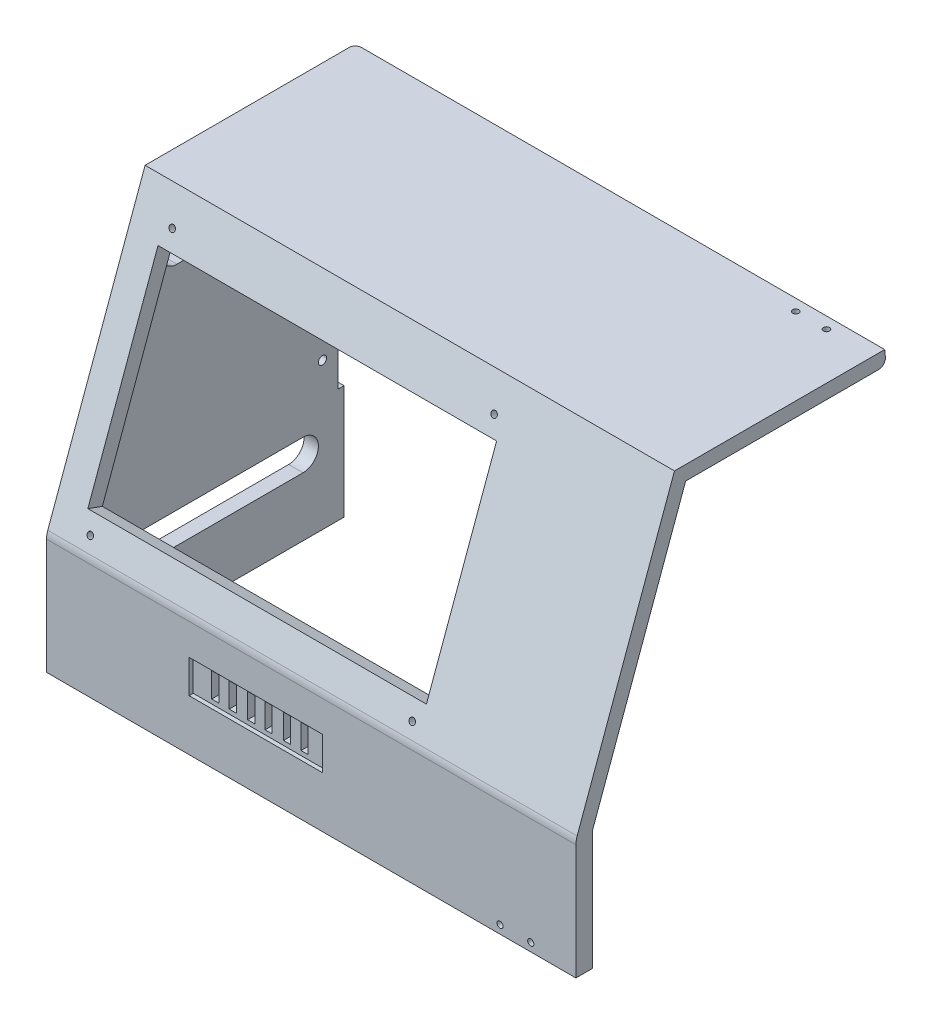
from build123d import *

# Parameters (mm, degrees)
SKETCH1_W                = 170
SKETCH1_H                = 130
BOSS_EXTRUDE1_DEPTH      = 8
SKETCH2_R                = 1.5
SKETCH2_W                = 165
SKETCH2_H                = 100
CUT_EXTRUDE1_DEPTH       = 21
SKETCH3_W                = 170
SKETCH3_H                = 20
BOSS_EXTRUDE2_DEPTH      = 8
SKETCH4_W                = 65
SKETCH4_H                = 16.2
CUT_EXTRUDE2_DEPTH       = 2
SKETCH5_W                = 3.5
SKETCH5_H                = 12
CUT_EXTRUDE3_DEPTH       = 35
SKETCH6_W                = 170
SKETCH6_H                = 150
BOSS_EXTRUDE3_DEPTH      = 8
BOSS_EXTRUDE4_DEPTH      = 138
SKETCH8_W                = 249
SKETCH8_H                = 138
BOSS_EXTRUDE5_DEPTH      = 1
SKETCH9_W                = 72.8
SKETCH9_H                = 73.25
CUT_EXTRUDE4_DEPTH       = 19
BOSS_EXTRUDE6_DEPTH      = 5
SKETCH11_R               = 1.5
CUT_EXTRUDE5_DEPTH       = 56
SKETCH12_R               = 9
SKETCH12_R_2             = 6.5
SKETCH12_R_3             = 1
SKETCH12_R_4             = 2.75
CUT_EXTRUDE6_DEPTH       = 115
SKETCH13_W               = 58.59049163
SKETCH13_H               = 30.075830986
CUT_EXTRUDE7_DEPTH       = 3
FILLET1_R                = 2
SKETCH15_R               = 1.5
CUT_EXTRUDE8_DEPTH       = 10
CUT_EXTRUDE10_DEPTH      = 261
SKETCH19_R               = 1.5
BOSS_EXTRUDE7_DEPTH      = 8
BOSS_EXTRUDE12_START     = -124.5
BOSS_EXTRUDE12_DEPTH     = 249
SKETCH22_R               = 1.5
SKETCH22_W               = 165
SKETCH22_H               = 100
CUT_EXTRUDE11_DEPTH      = 18
FILLET2_R                = 10
SKETCH24_R               = 2
SKETCH24_W               = 3
SKETCH24_H               = 72
CUT_EXTRUDE15_DEPTH      = 42
CUT_EXTRUDE16_DEPTH      = 140
CUT_EXTRUDE16_DEPTH_BACK = 242
SKETCH27_W               = 249
SKETCH27_H               = 105
BOSS_EXTRUDE13_DEPTH     = 7
CUT_EXTRUDE17_DEPTH      = 249
FILLET6_R                = 3
FILLET7_R                = 3
BOSS_EXTRUDE14_DEPTH     = 9
SKETCH30_R               = 1.5
CUT_EXTRUDE18_DEPTH      = 10
SKETCH31_R               = 1.5
CUT_EXTRUDE19_DEPTH      = 49
CUT_EXTRUDE20_DEPTH      = 49


with BuildPart() as part:
    # Sketch1 → Boss-Extrude1 (new body)
    with BuildSketch(Plane.XY):
        with Locations((85, 65)):
            Rectangle(SKETCH1_W, SKETCH1_H)
    extrude(amount=BOSS_EXTRUDE1_DEPTH)

    # Sketch2 → Cut-Extrude1 (cut)
    with BuildSketch(Plane.XY.offset(8)):
        with Locations((6.55, 123.35)):
            Circle(SKETCH2_R)
        with Locations((163.45, 123.35)):
            Circle(SKETCH2_R)
        with Locations((6.55, 6.65)):
            Circle(SKETCH2_R)
        with Locations((163.45, 6.65)):
            Circle(SKETCH2_R)
        with Locations((85, 65)):
            Rectangle(SKETCH2_W, SKETCH2_H)
    extrude(amount=-CUT_EXTRUDE1_DEPTH, mode=Mode.SUBTRACT)

    # Sketch3 → Boss-Extrude2 (add)
    with BuildSketch(Plane.XY.offset(8)):
        with Locations((85, -10)):
            Rectangle(SKETCH3_W, SKETCH3_H)
    extrude(amount=-BOSS_EXTRUDE2_DEPTH)

    # Sketch4 → Cut-Extrude2 (cut)
    with BuildSketch(Plane.XY.offset(8)):
        with Locations((85, -10)):
            Rectangle(SKETCH4_W, SKETCH4_H)
    extrude(amount=-CUT_EXTRUDE2_DEPTH, mode=Mode.SUBTRACT)

    # Sketch5 → Cut-Extrude3 (cut)
    with BuildSketch(Plane.XY.offset(6)):
        with Locations((63.25, -10)):
            Rectangle(SKETCH5_W, SKETCH5_H)
        with Locations((71.75, -10)):
            Rectangle(SKETCH5_W, SKETCH5_H)
        with Locations((80.75, -10)):
            Rectangle(SKETCH5_W, SKETCH5_H)
        with Locations((89.25, -10)):
            Rectangle(SKETCH5_W, SKETCH5_H)
        with Locations((98.25, -10)):
            Rectangle(SKETCH5_W, SKETCH5_H)
        with Locations((106.75, -10)):
            Rectangle(SKETCH5_W, SKETCH5_H)
    extrude(amount=-CUT_EXTRUDE3_DEPTH, mode=Mode.SUBTRACT)

    # Sketch6 → Boss-Extrude3 (add)
    with BuildSketch(Plane.XY.offset(8)):
        Polygon((15.504384948, 140), (225, 140), (225, -35), (-10, -35), (-10, 140), align=None)
        with Locations((85, 55)):
            Rectangle(SKETCH6_W, SKETCH6_H, mode=Mode.SUBTRACT)
    extrude(amount=-BOSS_EXTRUDE3_DEPTH)

    # Sketch7 → Boss-Extrude4 (add)
    with BuildSketch(Plane.XY.offset(8)):
        Polygon((-10, 140), (-17, 140), (-17, -42), (232, -42), (232, 140), (225, 140), (225, -35), (-10, -35), align=None)
    extrude(amount=-BOSS_EXTRUDE4_DEPTH)

    # Sketch8 → Boss-Extrude5 (add)
    with BuildSketch(Plane.XZ.offset(42)):
        with Locations((107.5, -61)):
            Rectangle(SKETCH8_W, SKETCH8_H)
    extrude(amount=BOSS_EXTRUDE5_DEPTH)

    # Sketch9 → Cut-Extrude4 (cut)
    with BuildSketch(Plane(origin=(232, 0, 0), x_dir=(0, 0, -1), z_dir=(1, 0, 0))):
        with Locations((75, 35)):
            Rectangle(SKETCH9_W, SKETCH9_H)
    extrude(amount=-CUT_EXTRUDE4_DEPTH, mode=Mode.SUBTRACT)

    # Sketch10 → Boss-Extrude6 (add)
    with BuildSketch(Plane(origin=(232, 0, 0), x_dir=(0, 0, -1), z_dir=(1, 0, 0))):
        Polygon((36, 44), (36, -4), (114, -4), (114, 44), (119, 44), (119, -9), (31, -9), (31, 44), align=None)
    extrude(amount=BOSS_EXTRUDE6_DEPTH)

    # Sketch11 → Cut-Extrude5 (cut)
    with BuildSketch(Plane(origin=(237, 0, 0), x_dir=(0, 0, -1), z_dir=(1, 0, 0))):
        with Locations((33.5, 17.5)):
            Circle(SKETCH11_R)
        with Locations((116.5, 17.5)):
            Circle(SKETCH11_R)
    extrude(amount=-CUT_EXTRUDE5_DEPTH, mode=Mode.SUBTRACT)

    # Sketch12 → Cut-Extrude6 (cut)
    with BuildSketch(Plane(origin=(0, -35, 0), x_dir=(1, 0, 0), z_dir=(0, 1, 0))):
        with Locations(Location((166.25, 32.5, 0), (0, 0, 180))):
            Circle(SKETCH12_R)
        with Locations(Location((166.25, 97.5, 0), (0, 0, 180))):
            Circle(SKETCH12_R_2)
        with Locations(Location((155.75, 97.5, 0), (0, 0, 180))):
            Circle(SKETCH12_R_3)
        with Locations(Location((155.75, 85, 0), (0, 0, 180))):
            Circle(SKETCH12_R_3)
        with Locations(Location((176.75, 85, 0), (0, 0, 180))):
            Circle(SKETCH12_R_3)
        with Locations(Location((176.75, 97.5, 0), (0, 0, 180))):
            Circle(SKETCH12_R_3)
        with Locations(Location((145.25, 97.5, 0), (0, 0, 180))):
            Circle(SKETCH12_R_4)
        with Locations(Location((187.25, 97.5, 0), (0, 0, 180))):
            Circle(SKETCH12_R_4)
    extrude(amount=-CUT_EXTRUDE6_DEPTH, mode=Mode.SUBTRACT)

    # Sketch13 → Cut-Extrude7 (cut)
    with BuildSketch(Plane.XZ.offset(43)):
        with Locations((166.25, -93.48757215)):
            Rectangle(SKETCH13_W, SKETCH13_H)
    extrude(amount=-CUT_EXTRUDE7_DEPTH, mode=Mode.SUBTRACT)

    # Fillet1
    fillet1_edges = [part.edges().sort_by_distance(p)[0] for p in [
        (136.954754185, -40, -93.48757215),
        (166.25, -40, -78.449656657),
        (195.545245815, -40, -93.48757215),
        (166.25, -40, -108.525487643),
    ]]
    fillet(fillet1_edges, radius=FILLET1_R)

    # Sketch15 → Cut-Extrude8 (cut)
    with BuildSketch(Plane(origin=(0, 140, 0), x_dir=(1, 0, 0), z_dir=(0, 1, 0))):
        with Locations(Location((5, -4, 0), (0, 0, 270))):
            Circle(SKETCH15_R)
        with Locations(Location((20, -4, 0), (0, 0, 270))):
            Circle(SKETCH15_R)
        with Locations(Location((217, -4, 0), (0, 0, 90))):
            Circle(SKETCH15_R)
        with Locations(Location((202, -4, 0), (0, 0, 90))):
            Circle(SKETCH15_R)
    extrude(amount=-CUT_EXTRUDE8_DEPTH, mode=Mode.SUBTRACT)

    # Sketch18 → Cut-Extrude10 (cut)
    with BuildSketch(Plane(origin=(232, 0, 0), x_dir=(0, 0, -1), z_dir=(1, 0, 0))):
        Polygon((45.496279283, 140), (-8, 140), (-8, 15), (0, 15), align=None)
    extrude(amount=-CUT_EXTRUDE10_DEPTH, mode=Mode.SUBTRACT)

    # Sketch19 → Boss-Extrude7 (add)
    with BuildSketch(Plane.XY.offset(8)):
        with Locations((6.55, 6.65)):
            Circle(SKETCH19_R)
        with Locations((163.45, 6.65)):
            Circle(SKETCH19_R)
    extrude(amount=-BOSS_EXTRUDE7_DEPTH)

    # Sketch21 → Boss-Extrude12 (add)
    with BuildSketch(Plane(origin=(107.5, 0, 0), x_dir=(0, 0, -1), z_dir=(1, 0, 0)).offset(BOSS_EXTRUDE12_START)):
        Polygon((45.496279283, 140), (0, 15), (-8, 15), (37.496279283, 140), align=None)
    extrude(amount=BOSS_EXTRUDE12_DEPTH)

    # Sketch22 → Cut-Extrude11 (cut)
    with BuildSketch(Plane(origin=(0, 4.325817115, 11.885084845), x_dir=(1, 0, 0), z_dir=(0, 0.3420201433256603, 0.9396926207859115))):
        with Locations(Location((1.55, 136.220338945, 0), (0, 0, 270))):
            Circle(SKETCH22_R)
        with Locations(Location((158.45, 136.220338945, 0), (0, 0, 270))):
            Circle(SKETCH22_R)
        with Locations(Location((1.55, 19.520338945, 0), (0, 0, 270))):
            Circle(SKETCH22_R)
        with Locations(Location((158.45, 19.520338945, 0), (0, 0, 270))):
            Circle(SKETCH22_R)
        with Locations((80, 77.870338945)):
            Rectangle(SKETCH22_W, SKETCH22_H)
    extrude(amount=-CUT_EXTRUDE11_DEPTH, mode=Mode.SUBTRACT)

    # Fillet2
    fillet2_edges = [part.edges().sort_by_distance(p)[0] for p in [
        (107.5, 15, 8),
    ]]
    fillet(fillet2_edges, radius=FILLET2_R)

    # Sketch24 → Cut-Extrude15 (cut)
    with BuildSketch(Plane(origin=(-10, 0, 0), x_dir=(0, 0, -1), z_dir=(1, 0, 0))):
        with Locations(Location((113.5, 48.5, 0), (0, 0, 90))):
            Circle(SKETCH24_R)
        with Locations(Location((119.5, 68.5, 0), (0, 0, 90))):
            Circle(SKETCH24_R)
        with Locations(Location((119.5, 28.5, 0), (0, 0, 90))):
            Circle(SKETCH24_R)
        with Locations((128.5, 48.5)):
            Rectangle(SKETCH24_W, SKETCH24_H)
    extrude(amount=-CUT_EXTRUDE15_DEPTH, mode=Mode.SUBTRACT)

    # Sketch25 → Cut-Extrude16 (cut, two sides: drawn at the far end of the back side and taken through both)
    with BuildSketch(Plane(origin=(232, 0, 0), x_dir=(0, 0, -1), z_dir=(1, 0, 0)).offset(-CUT_EXTRUDE16_DEPTH_BACK)):
        Polygon((45.496279283, 140), (130, 140), (130, -43), (0, -43), (0, 15), align=None)
    extrude(amount=CUT_EXTRUDE16_DEPTH + CUT_EXTRUDE16_DEPTH_BACK, mode=Mode.SUBTRACT)

    # Sketch27 → Boss-Extrude13 (add)
    with BuildSketch(Plane(origin=(0, 140, 0), x_dir=(1, 0, 0), z_dir=(0, 1, 0))):
        with Locations((107.5, 89.996279283)):
            Rectangle(SKETCH27_W, SKETCH27_H)
    extrude(amount=BOSS_EXTRUDE13_DEPTH)

    # Sketch28 → Cut-Extrude17 (cut)
    with BuildSketch(Plane(origin=(232, 0, 0), x_dir=(0, 0, -1), z_dir=(1, 0, 0))):
        Polygon((37.496279283, 140), (40.044070923, 147), (37.496279283, 147), align=None)
    extrude(amount=-CUT_EXTRUDE17_DEPTH, mode=Mode.SUBTRACT)

    # Fillet6
    fillet6_edges = [part.edges().sort_by_distance(p)[0] for p in [
        (107.5, 140, -142.496279283),
    ]]
    fillet(fillet6_edges, radius=FILLET6_R)

    # Fillet7
    fillet7_edges = [part.edges().sort_by_distance(p)[0] for p in [
        (-17, 145, -142.496279283),
        (-17, 140, -134.748139642),
        (-17, 140.878679656, -141.617599627),
    ]]
    fillet(fillet7_edges, radius=FILLET7_R)

    # Sketch29 → Boss-Extrude14 (add)
    with BuildSketch(Plane(origin=(232, 0, 0), x_dir=(0, 0, -1), z_dir=(1, 0, 0))):
        with BuildLine():
            Line((-8, -43), (0, -43))
            Line((0, -43), (0, 15))
            Line((0, 15), (45.496279283, 140))
            Line((45.496279283, 140), (139.496279283, 140))
            ThreePointArc((139.496279283, 140), (141.886652657, 140.990125071), (142.876777727, 143.380498444))
            Line((142.876777727, 143.380498444), (142.496279283, 147))
            Line((142.496279283, 147), (40.044070923, 147))
            Line((40.044070923, 147), (-7.396926208, 16.656931626))
            ThreePointArc((-7.396926208, 16.656931626), (-7.84807753, 14.97321197), (-8, 13.236730193))
            Line((-8, 13.236730193), (-8, -43))
        make_face()
    extrude(amount=BOSS_EXTRUDE14_DEPTH)

    # Sketch30 → Cut-Extrude18 (cut)
    with BuildSketch(Plane(origin=(0, 147, 0), x_dir=(1, 0, 0), z_dir=(0, 1, 0))):
        with Locations(Location((218.25, 136.876777727, 0), (0, 0, 270))):
            Circle(SKETCH30_R)
        with Locations(Location((203.25, 136.876777727, 0), (0, 0, 270))):
            Circle(SKETCH30_R)
    extrude(amount=-CUT_EXTRUDE18_DEPTH, mode=Mode.SUBTRACT)

    # Sketch31 → Cut-Extrude19 (cut)
    with BuildSketch(Plane.XY.offset(8)):
        with Locations((219, -39)):
            Circle(SKETCH31_R)
        with Locations((204, -39)):
            Circle(SKETCH31_R)
    extrude(amount=-CUT_EXTRUDE19_DEPTH, mode=Mode.SUBTRACT)

    # Sketch32 → Cut-Extrude20 (cut)
    with BuildSketch(Plane.ZY.offset(17)):
        with BuildLine():
            Line((-110, 0.736730193), (-12, 0.736730193))
            ThreePointArc((-12, 0.736730193), (-4.5, -6.763269807), (-12, -14.263269807))
            Line((-12, -14.263269807), (-110, -14.263269807))
            ThreePointArc((-110, -14.263269807), (-117.5, -6.763269807), (-110, 0.736730193))
        make_face()
        with BuildLine():
            Line((-110, 119.5), (-48.588668173, 119.5))
            ThreePointArc((-48.588668173, 119.5), (-41.088668173, 112), (-48.588668173, 104.5))
            Line((-48.588668173, 104.5), (-110, 104.5))
            ThreePointArc((-110, 104.5), (-117.5, 112), (-110, 119.5))
        make_face()
    extrude(amount=-CUT_EXTRUDE20_DEPTH, mode=Mode.SUBTRACT)


solid = part.part
